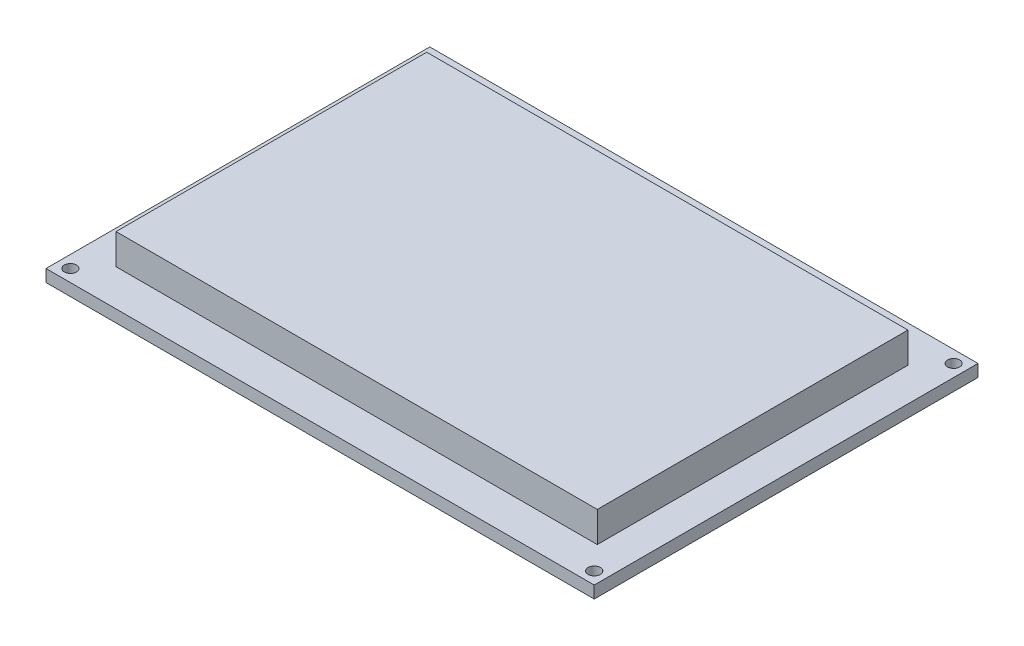
from build123d import *

# Parameters (mm, degrees)
SKETCH_1_W          = 90
SKETCH_1_H          = 63
EXTRUDE_1_DEPTH     = 2
SKETCH_2_W          = 79
SKETCH_2_H          = 51
EXTRUDE_2_DEPTH     = 5
SKETCH_3_R          = 1
CUT_EXTRUDE_1_DEPTH = 75.760510392


with BuildPart() as part:
    # 草图1 → 凸台-拉伸1 (new body)
    with BuildSketch(Plane(origin=(0, 0, 0), x_dir=(1, 0, 0), z_dir=(0, 1, 0))):
        with Locations((14.879032258, -12.981854839)):
            Rectangle(SKETCH_1_W, SKETCH_1_H)
    extrude(amount=EXTRUDE_1_DEPTH)

    # 草图2 → 凸台-拉伸2 (add)
    with BuildSketch(Plane(origin=(0, 2, 0), x_dir=(1, 0, 0), z_dir=(0, 1, 0))):
        with Locations((14.879032258, -12.981854839)):
            Rectangle(SKETCH_2_W, SKETCH_2_H)
    extrude(amount=EXTRUDE_2_DEPTH)

    # 草图3 → 切除-拉伸1 (cut, through all)
    with BuildSketch(Plane(origin=(0, 2, 0), x_dir=(1, 0, 0), z_dir=(0, 1, 0))):
        with Locations(Location((-28.120967742, 16.518145161, 0), (0, 0, 270))):
            Circle(SKETCH_3_R)
        with Locations(Location((-28.120967742, -42.481854839, 0), (0, 0, 270))):
            Circle(SKETCH_3_R)
        with Locations(Location((57.879032258, -42.481854839, 0), (0, 0, 270))):
            Circle(SKETCH_3_R)
        with Locations(Location((57.879032258, 16.518145161, 0), (0, 0, 270))):
            Circle(SKETCH_3_R)
    extrude(amount=-CUT_EXTRUDE_1_DEPTH, mode=Mode.SUBTRACT)


solid = part.part
